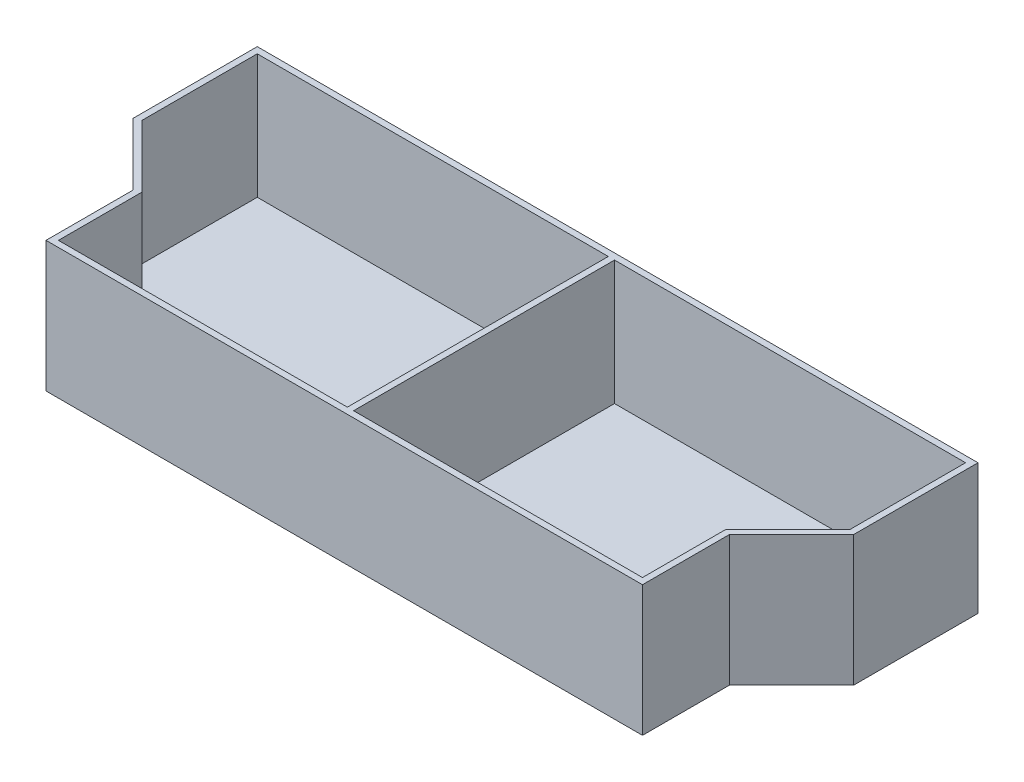
from build123d import *

# Parameters (mm, degrees)
BOSS_EXTRUDE1_DEPTH = 254
BOSS_EXTRUDE2_DEPTH = 12.7
SKETCH3_W           = 12.7
SKETCH3_H           = 533.4
BOSS_EXTRUDE3_DEPTH = 254


with BuildPart() as part:
    # Sketch1 → Boss-Extrude1 (new body)
    with BuildSketch(Plane(origin=(0, 0, 0), x_dir=(1, 0, 0), z_dir=(0, 1, 0))):
        Polygon((0, 0), (-609.6, 0), (-609.6, 177.8), (-736.6, 304.8), (-736.6, 558.8), (736.6, 558.8), (736.6, 304.8), (609.6, 177.8), (609.6, 0), align=None)
        Polygon((-723.9, 310.060512242), (-723.9, 546.1), (723.9, 546.1), (723.9, 310.060512242), (596.9, 183.060512242), (596.9, 12.7), (0, 12.7), (-596.9, 12.7), (-596.9, 183.060512242), align=None, mode=Mode.SUBTRACT)
    extrude(amount=BOSS_EXTRUDE1_DEPTH)

    # Sketch2 → Boss-Extrude2 (add)
    with BuildSketch(Plane.XZ):
        Polygon((609.6, -177.8), (609.6, 0), (-609.6, 0), (-609.6, -177.8), (-736.6, -304.8), (-736.6, -558.8), (736.6, -558.8), (736.6, -304.8), align=None)
    extrude(amount=BOSS_EXTRUDE2_DEPTH)

    # Sketch3 → Boss-Extrude3 (add)
    with BuildSketch(Plane(origin=(0, 0, 0), x_dir=(1, 0, 0), z_dir=(0, 1, 0))):
        with Locations((0, 279.4)):
            Rectangle(SKETCH3_W, SKETCH3_H)
    extrude(amount=BOSS_EXTRUDE3_DEPTH)


solid = part.part
